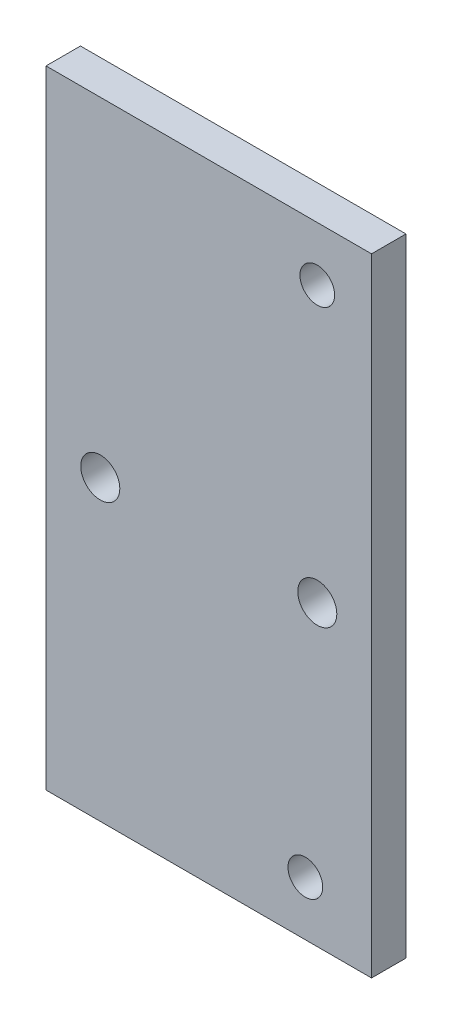
from build123d import *

# Parameters (mm, degrees)
SKETCH1_W           = 30
SKETCH1_H           = 57.8
SKETCH1_R           = 1.6
SKETCH1_R_2         = 1.8
BOSS_EXTRUDE1_DEPTH = 3.175


with BuildPart() as part:
    # Sketch1 → Boss-Extrude1 (new body)
    with BuildSketch(Plane.XY):
        with Locations((112.736428571, 1.448214286)):
            Rectangle(SKETCH1_W, SKETCH1_H)
        with Locations((121.636428571, -22.451785714)):
            Circle(SKETCH1_R, mode=Mode.SUBTRACT)
        with Locations((122.736428571, 25.348214286)):
            Circle(SKETCH1_R, mode=Mode.SUBTRACT)
        with Locations((102.736428571, 0)):
            Circle(SKETCH1_R_2, mode=Mode.SUBTRACT)
        with Locations((122.736428571, 0)):
            Circle(SKETCH1_R_2, mode=Mode.SUBTRACT)
    extrude(amount=BOSS_EXTRUDE1_DEPTH)


solid = part.part
